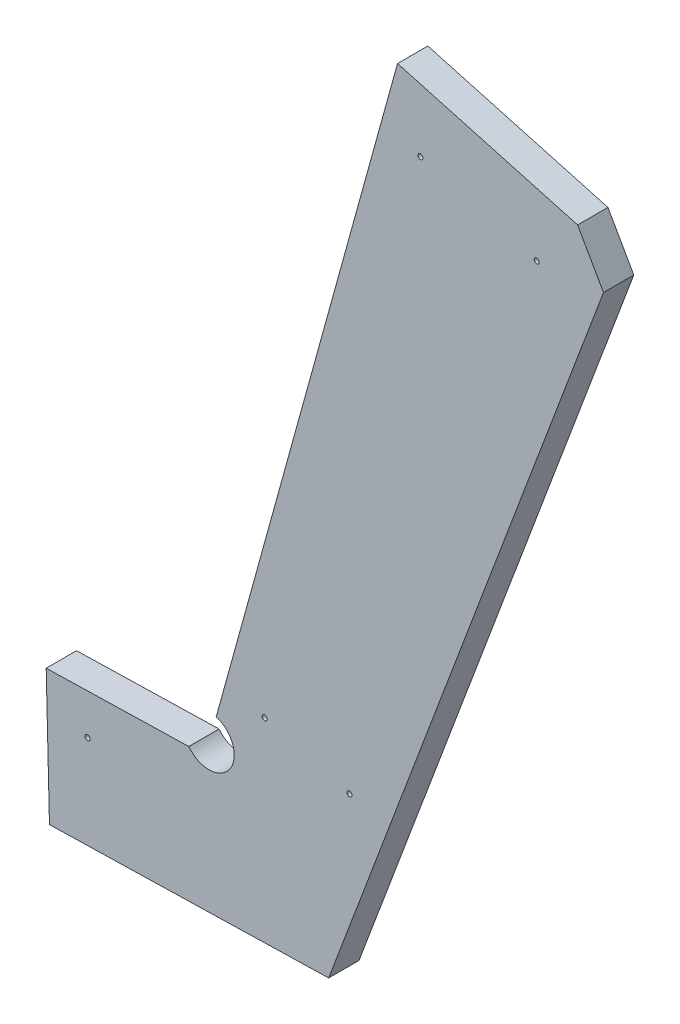
from build123d import *

# Parameters (mm, degrees)
BOSS_EXTRUDE1_DEPTH = 19.05
HOLE2_D             = 3.175
HOLE2_DEPTH         = 31.75
HOLE2_CSINK_D       = 10.16
HOLE2_CSINK_ANGLE   = 82
HOLE2_TIP           = 0.953866233
HOLE3_D             = 3.175
HOLE3_DEPTH         = 38.1
HOLE3_CSINK_D       = 10.16
HOLE3_CSINK_ANGLE   = 82
HOLE3_TIP           = 0.953866233


with BuildPart() as part:
    # Sketch1 → Boss-Extrude1 (new body)
    with BuildSketch(Plane.XY):
        with BuildLine():
            Line((-45.645654956, -462.283590669), (-43.591869521, -546.396382838))
            Line((-43.591869521, -546.396382838), (131.845939781, -542.11271078))
            Line((131.845939781, -542.11271078), (304.502022379, -82.799914861))
            Line((304.502022379, -82.799914861), (288.249001778, -54.142860136))
            Line((288.249001778, -54.142860136), (175.093421906, -22.889613201))
            Line((175.093421906, -22.889613201), (61.177817241, -435.332721236))
            ThreePointArc((61.177817241, -435.332721236), (69.660650717, -459.60790015), (43.950640658, -460.09591431))
            Line((43.950640658, -460.09591431), (-45.645654956, -462.283590669))
        make_face()
    extrude(amount=BOSS_EXTRUDE1_DEPTH)

    # Hole2
    with Locations(Plane(origin=(162.245907498, -21.702082459, 165.474999994), x_dir=(0, 0, -1), z_dir=(-0.9639097761610324, 0.2662291182819574, 0))):
        with Locations((-155.949999994, 107.734820482), (155.949999994, 107.734820482), (155.949999994, 327.755881328), (174.999999994, 85.732714397), (174.999999994, 349.757987412), (-174.999999994, 349.757987412), (-174.999999994, 85.732714397), (-155.949999994, 327.755881328)):
            CounterSinkHole(HOLE2_D / 2, HOLE2_CSINK_D / 2, depth=HOLE2_DEPTH, counter_sink_angle=HOLE2_CSINK_ANGLE)
            with Locations((0, 0, -(HOLE2_DEPTH + HOLE2_TIP / 2))):  # 118° drill point
                Cone(0, HOLE2_D / 2, HOLE2_TIP, mode=Mode.SUBTRACT)

    # Hole3
    with Locations(Plane(origin=(311.92831292, -63.043933951, -19.05), x_dir=(-0.3518626346959965, -0.9360516472421764, 8.51430303154421e-15), z_dir=(0, 0, -1))):
        with Locations((46.221112845, 113.488854888), (39.39759596, 37.945520226), (412.28786892, 80.423559293), (407.308516105, 25.297013484), (513.561319184, 161.164706775), (597.46020397, 127.267357003), (610.543339245, 159.649253123), (694.322923815, 367.011001477), (526.644454459, 193.546602895), (610.424039029, 400.908351249)):
            CounterSinkHole(HOLE3_D / 2, HOLE3_CSINK_D / 2, depth=HOLE3_DEPTH, counter_sink_angle=HOLE3_CSINK_ANGLE)
            with Locations((0, 0, -(HOLE3_DEPTH + HOLE3_TIP / 2))):  # 118° drill point
                Cone(0, HOLE3_D / 2, HOLE3_TIP, mode=Mode.SUBTRACT)


solid = part.part
